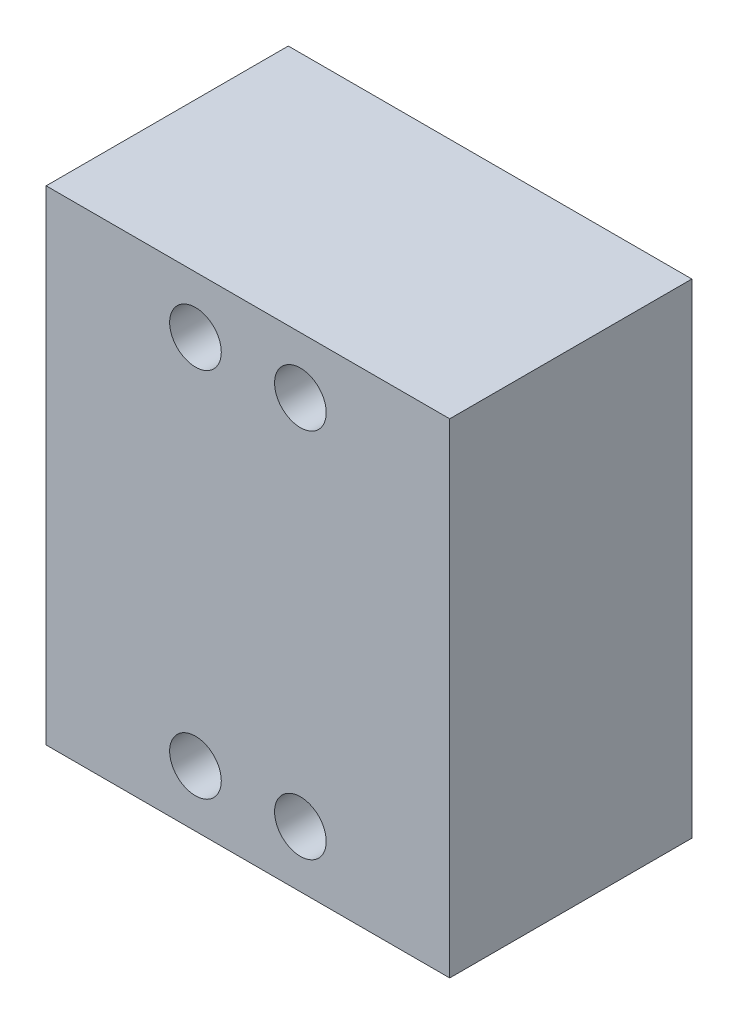
from build123d import *

# Parameters (mm, degrees)
SKETCH1_W            = 50
SKETCH1_H            = 60
BOSS_EXTRUDE1_DEPTH  = 30
M6_CLEARANCE_HOLE1_D = 6.4


with BuildPart() as part:
    # Sketch1 → Boss-Extrude1 (new body)
    with BuildSketch(Plane.XY):
        Rectangle(SKETCH1_W, SKETCH1_H)
    extrude(amount=BOSS_EXTRUDE1_DEPTH)

    # M6 Clearance Hole1 (through all)
    with Locations(Plane.XY.offset(30)):
        with Locations((-6.5, 23), (-6.5, -23), (6.5, -23), (6.5, 23)):
            Hole(M6_CLEARANCE_HOLE1_D / 2)


solid = part.part
